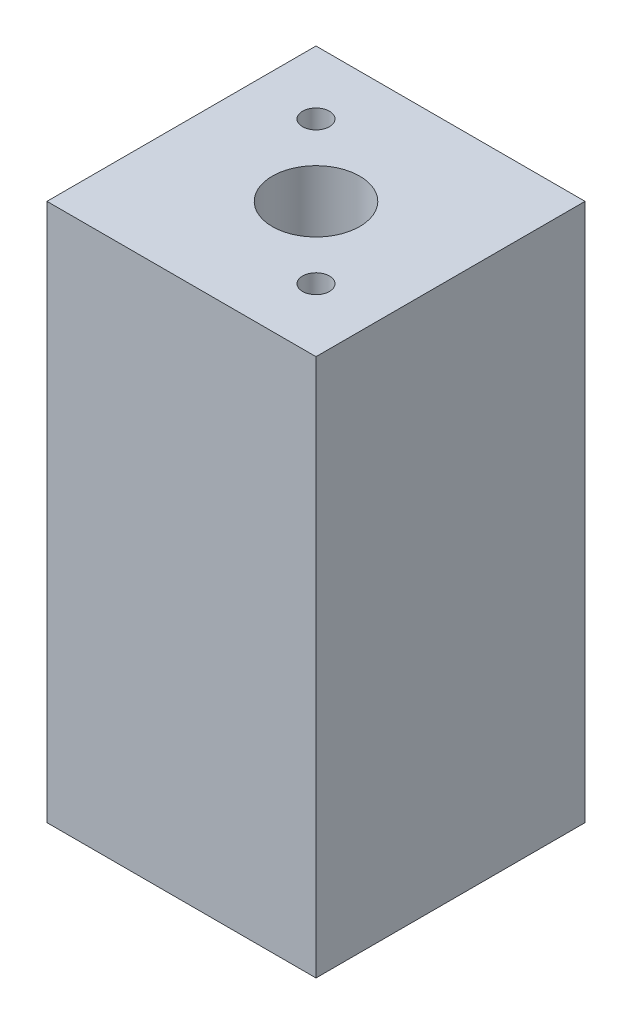
from build123d import *

# Parameters (mm, degrees)
ESQUISSE1_W        = 20
ESQUISSE1_H        = 20
ESQUISSE1_R        = 1
ESQUISSE1_R_2      = 3.25
BOSS_EXTRU_1_DEPTH = 40


with BuildPart() as part:
    # Esquisse1 → Boss.-Extru.1 (new body)
    with BuildSketch(Plane(origin=(0, 0, 0), x_dir=(1, 0, 0), z_dir=(0, 1, 0))):
        Rectangle(ESQUISSE1_W, ESQUISSE1_H)
        with Locations(Location((-5.303300859, 5.303300859, 0), (0, 0, 270))):
            Circle(ESQUISSE1_R, mode=Mode.SUBTRACT)
        with Locations(Location((5.303300859, -5.303300859, 0), (0, 0, 90))):
            Circle(ESQUISSE1_R, mode=Mode.SUBTRACT)
        with Locations(Location((0, 0, 0), (0, 0, 270))):
            Circle(ESQUISSE1_R_2, mode=Mode.SUBTRACT)
    extrude(amount=-BOSS_EXTRU_1_DEPTH)


solid = part.part
